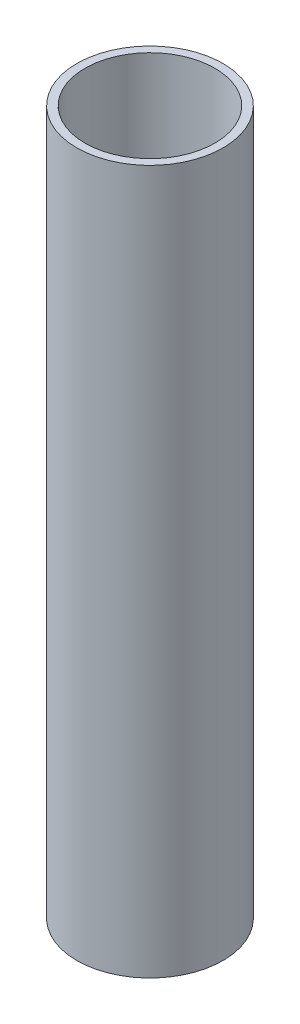
from build123d import *

# Parameters (mm, degrees)
SKETCH1_R           = 7.9375
SKETCH1_R_2         = 7.0485
BOSS_EXTRUDE1_DEPTH = 76.4


with BuildPart() as part:
    # Sketch1 → Boss-Extrude1 (new body)
    with BuildSketch(Plane(origin=(0, 0, 0), x_dir=(1, 0, 0), z_dir=(0, 1, 0))):
        with Locations(Location((13.632659162, 6.079429086, 0), (0, 0, 270))):
            Circle(SKETCH1_R)
        with Locations(Location((13.632659162, 6.079429086, 0), (0, 0, 270))):
            Circle(SKETCH1_R_2, mode=Mode.SUBTRACT)
    extrude(amount=BOSS_EXTRUDE1_DEPTH)


solid = part.part
